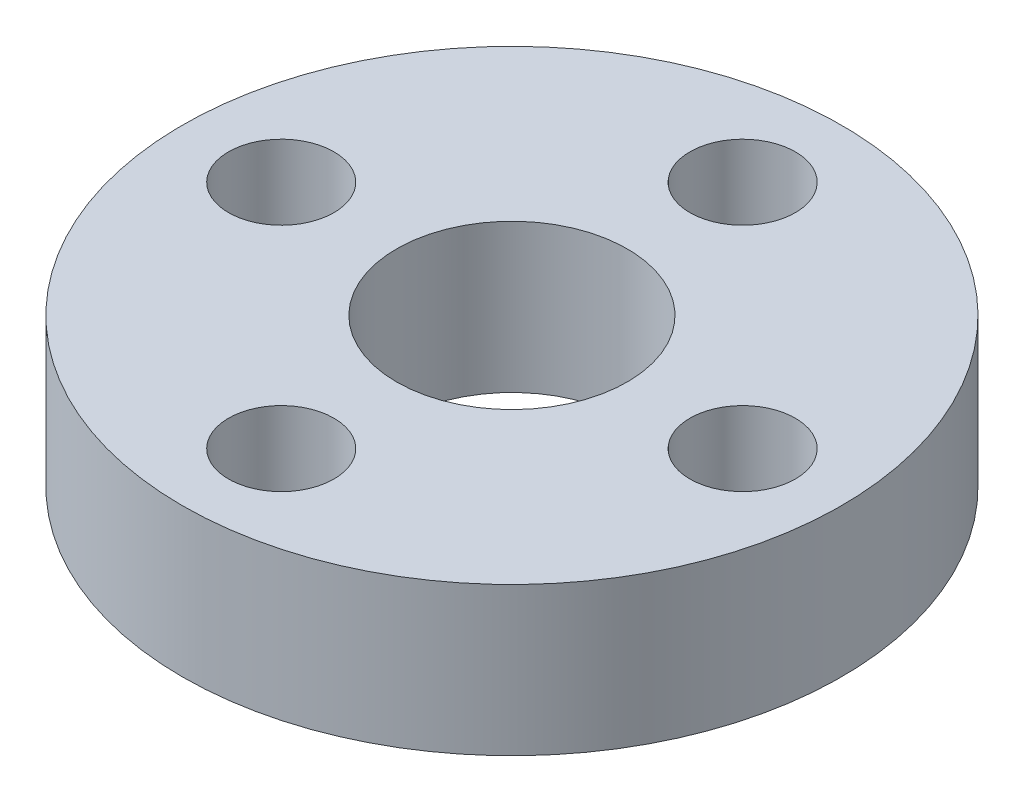
from build123d import *

# Parameters (mm, degrees)
SKETCH_1_R      = 10
SKETCH_1_R_2    = 1.6
SKETCH_1_R_3    = 3.5
EXTRUDE_1_DEPTH = 4.5


with BuildPart() as part:
    # 草图1 → 凸台-拉伸1 (new body)
    with BuildSketch(Plane(origin=(0, 0, 0), x_dir=(1, 0, 0), z_dir=(0, 1, 0))):
        with Locations(Location((0, 0, 0), (0, 0, 270))):
            Circle(SKETCH_1_R)
        with Locations(Location((0, 7, 0), (0, 0, 270))):
            Circle(SKETCH_1_R_2, mode=Mode.SUBTRACT)
        with Locations(Location((7, 0, 0), (0, 0, 270))):
            Circle(SKETCH_1_R_2, mode=Mode.SUBTRACT)
        with Locations(Location((0, 0, 0), (0, 0, 270))):
            Circle(SKETCH_1_R_3, mode=Mode.SUBTRACT)
        with Locations(Location((0, -7, 0), (0, 0, 90))):
            Circle(SKETCH_1_R_2, mode=Mode.SUBTRACT)
        with Locations(Location((-7, 0, 0), (0, 0, 90))):
            Circle(SKETCH_1_R_2, mode=Mode.SUBTRACT)
    extrude(amount=EXTRUDE_1_DEPTH)


solid = part.part
